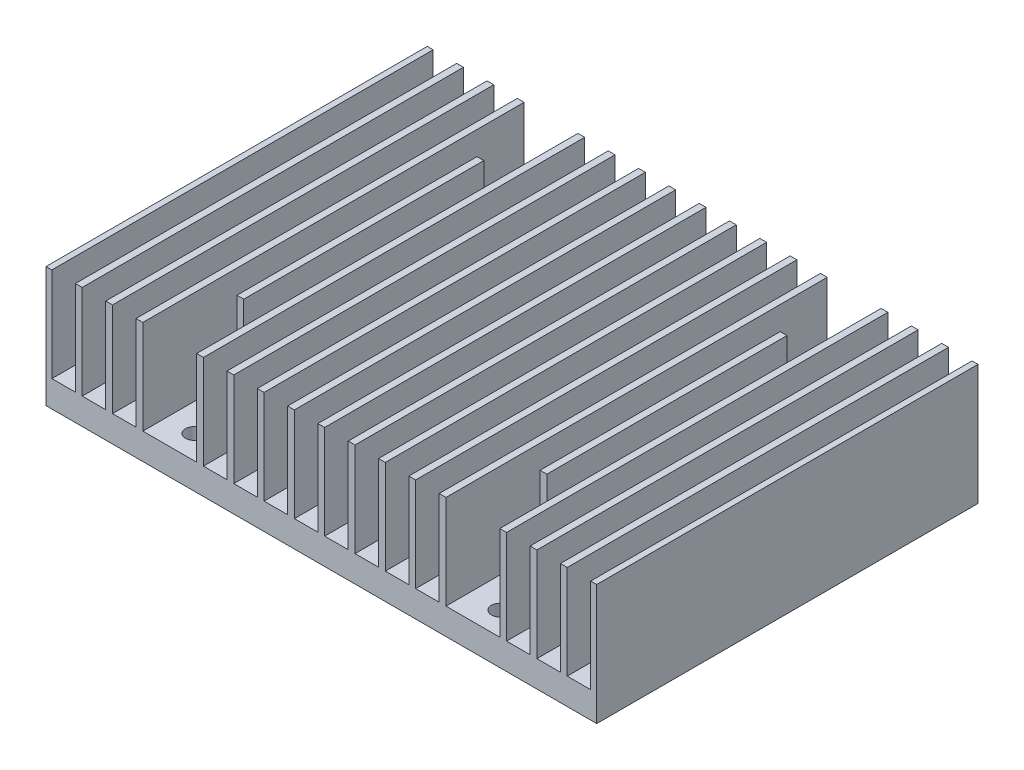
from build123d import *

# Parameters (mm, degrees)
SKETCH1_W          = 148.59
SKETCH1_H          = 102.87
EXTRUDE1_DEPTH     = 32.512
SKETCH2_W          = 6.35
SKETCH2_H          = 102.87
CUT_EXTRUDE1_DEPTH = 25.4
LPATTERN1_COUNT    = 18
LPATTERN1_PITCH    = 8.1788
SKETCH3_R          = 2.286
CUT_EXTRUDE2_DEPTH = 78.74
SKETCH4_W          = 1.8288
SKETCH4_H          = 19.05
CUT_EXTRUDE3_DEPTH = 25.4


with BuildPart() as part:
    # Sketch1 → Extrude1 (new body)
    with BuildSketch(Plane(origin=(0, 0, 0), x_dir=(1, 0, 0), z_dir=(0, 1, 0))):
        with Locations((74.295, 51.435)):
            Rectangle(SKETCH1_W, SKETCH1_H)
    extrude(amount=EXTRUDE1_DEPTH)

    # Sketch2 → Cut-Extrude1 (cut)
    with BuildSketch(Plane(origin=(0, 32.512, 0), x_dir=(-1, 0, 0), z_dir=(0, 1, 0))):
        with Locations((-4.7625, -51.435)):
            Rectangle(SKETCH2_W, SKETCH2_H)
    cut_extrude1 = extrude(amount=-CUT_EXTRUDE1_DEPTH, mode=Mode.SUBTRACT)

    # LPattern1: Cut-Extrude1 ×18
    with Locations(*[(i * LPATTERN1_PITCH, 0, 0) for i in range(1, LPATTERN1_COUNT)]):
        add(cut_extrude1, mode=Mode.SUBTRACT)

    # Sketch3 → Cut-Extrude2 (cut)
    with BuildSketch(Plane.XZ):
        with Locations(Location((33.5788, -6.35, 0), (0, 0, 270))):
            Circle(SKETCH3_R)
        with Locations(Location((33.5788, -94.742, 0), (0, 0, 270))):
            Circle(SKETCH3_R)
        with Locations(Location((116.1288, -6.35, 0), (0, 0, 270))):
            Circle(SKETCH3_R)
        with Locations(Location((116.1288, -94.742, 0), (0, 0, 270))):
            Circle(SKETCH3_R)
    extrude(amount=-CUT_EXTRUDE2_DEPTH, mode=Mode.SUBTRACT)

    # Sketch4 → Cut-Extrude3 (cut)
    with BuildSketch(Plane(origin=(0, 32.512, 0), x_dir=(-1, 0, 0), z_dir=(0, 1, 0))):
        with Locations((-33.3883, -93.345)):
            Rectangle(SKETCH4_W, SKETCH4_H)
        with Locations((-115.1763, -93.345)):
            Rectangle(SKETCH4_W, SKETCH4_H)
        with Locations((-33.3883, -9.525)):
            Rectangle(SKETCH4_W, SKETCH4_H)
        with Locations((-115.1763, -9.525)):
            Rectangle(SKETCH4_W, SKETCH4_H)
    extrude(amount=-CUT_EXTRUDE3_DEPTH, mode=Mode.SUBTRACT)


solid = part.part
